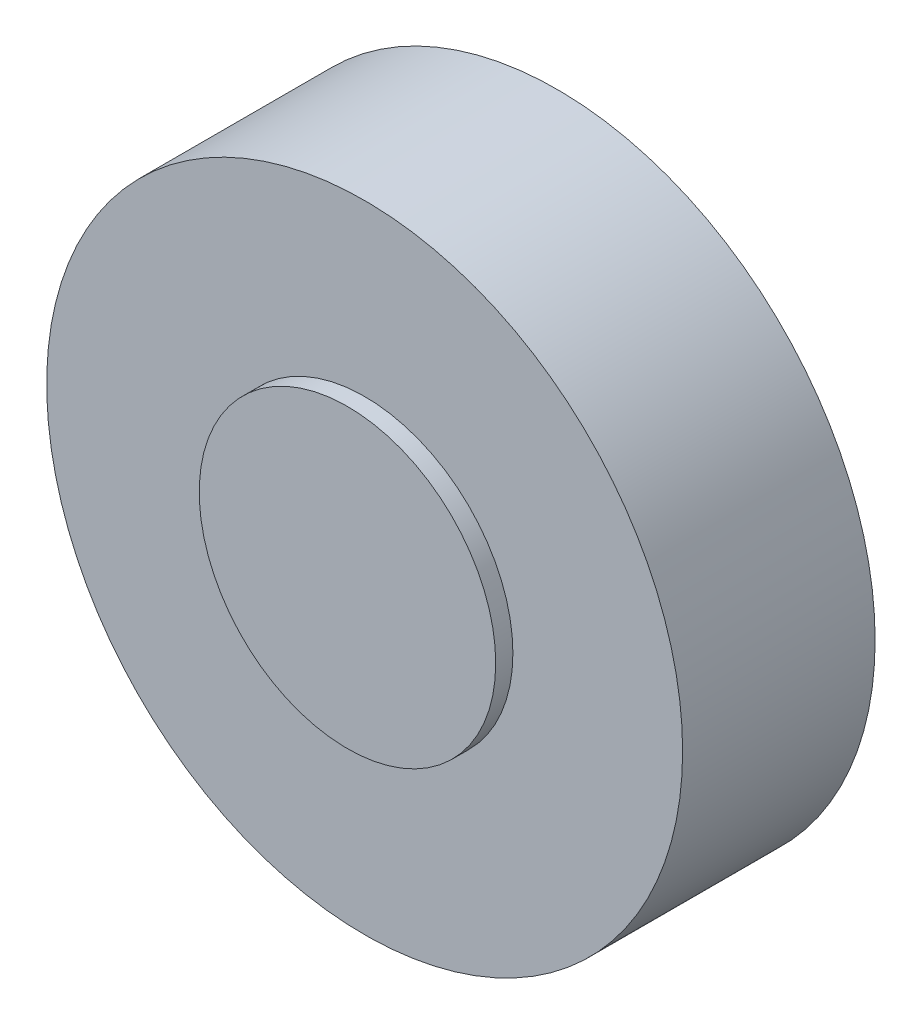
from build123d import *

# Parameters (mm, degrees)
SKETCH_1_R          = 74
EXTRUDE_1_DEPTH     = 44.8
SKETCH_3_R          = 34.5
EXTRUDE_2_DEPTH     = 4
CUT_EXTRUDE_3_DEPTH = 4


with BuildPart() as part:
    # 草图1 → 凸台-拉伸1 (new body)
    with BuildSketch(Plane.XY):
        Circle(SKETCH_1_R)
    extrude(amount=EXTRUDE_1_DEPTH)

    # 草图3 → 凸台-拉伸2 (add)
    with BuildSketch(Plane.XY.offset(44.8)):
        Circle(SKETCH_3_R)
    extrude(amount=EXTRUDE_2_DEPTH)

    # 草图4 → 切除-拉伸3 (cut)
    with BuildSketch(Plane(origin=(0, 0, 0), x_dir=(1, 0, 0), z_dir=(0, 0, -1))):
        Polygon((55.454566514, -11.572321894), (0, 0), (56.650713471, 10.308727493), (48.957646125, -0.806969816), align=None)
    extrude(amount=-CUT_EXTRUDE_3_DEPTH, mode=Mode.SUBTRACT)


solid = part.part
